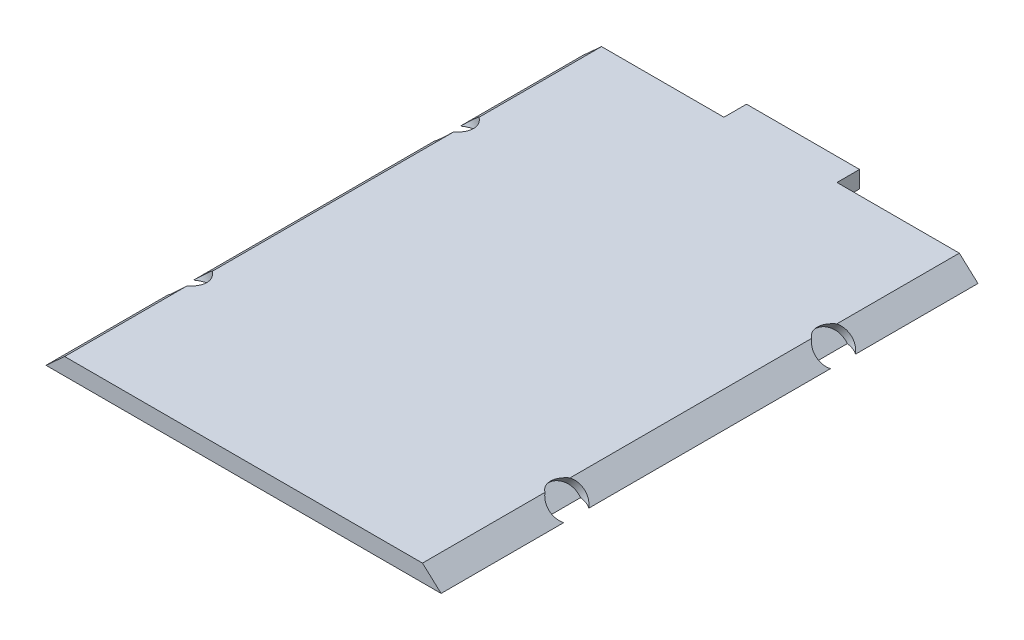
from build123d import *

# Parameters (mm, degrees)
BOSS_EXTRUDE1_DEPTH = 120.65
SKETCH2_W           = 25.4
SKETCH2_H           = 5.08
BOSS_EXTRUDE2_DEPTH = 3.81
SKETCH3_R           = 4
CUT_EXTRUDE1_DEPTH  = 2
SKETCH4_R           = 4
CUT_EXTRUDE2_DEPTH  = 2


with BuildPart() as part:
    # Sketch1 → Boss-Extrude1 (new body)
    with BuildSketch(Plane.XY):
        Polygon((-40.203883769, 5.937788296), (40.203883769, 5.937788296), (44.399042974, 2.127788296), (-44.399042974, 2.127788296), align=None)
    extrude(amount=BOSS_EXTRUDE1_DEPTH)

    # Sketch2 → Boss-Extrude2 (add)
    with BuildSketch(Plane.XZ.offset(-2.127788296)):
        with Locations((0, -2.54)):
            Rectangle(SKETCH2_W, SKETCH2_H)
    extrude(amount=-BOSS_EXTRUDE2_DEPTH)

    # Sketch3 → Cut-Extrude1 (cut)
    with BuildSketch(Plane(origin=(-21.127225221, 23.263011377, 0), x_dir=(0.7402720771062569, 0.6723074087475075, 0), z_dir=(-0.6723074087475075, 0.7402720771062569, 0))):
        with Locations((-28.603318705, -30.353)):
            Circle(SKETCH3_R)
        with Locations((-28.603318705, -90.297)):
            Circle(SKETCH3_R)
    extrude(amount=-CUT_EXTRUDE1_DEPTH, mode=Mode.SUBTRACT)

    # Sketch4 → Cut-Extrude2 (cut)
    with BuildSketch(Plane(origin=(21.127225221, 23.263011377, 0), x_dir=(0.7402720771062569, -0.6723074087475075, 0), z_dir=(0.6723074087475075, 0.7402720771062569, 0))):
        with Locations((28.603318705, -90.297)):
            Circle(SKETCH4_R)
        with Locations((28.603318705, -30.353)):
            Circle(SKETCH4_R)
    extrude(amount=-CUT_EXTRUDE2_DEPTH, mode=Mode.SUBTRACT)


solid = part.part
